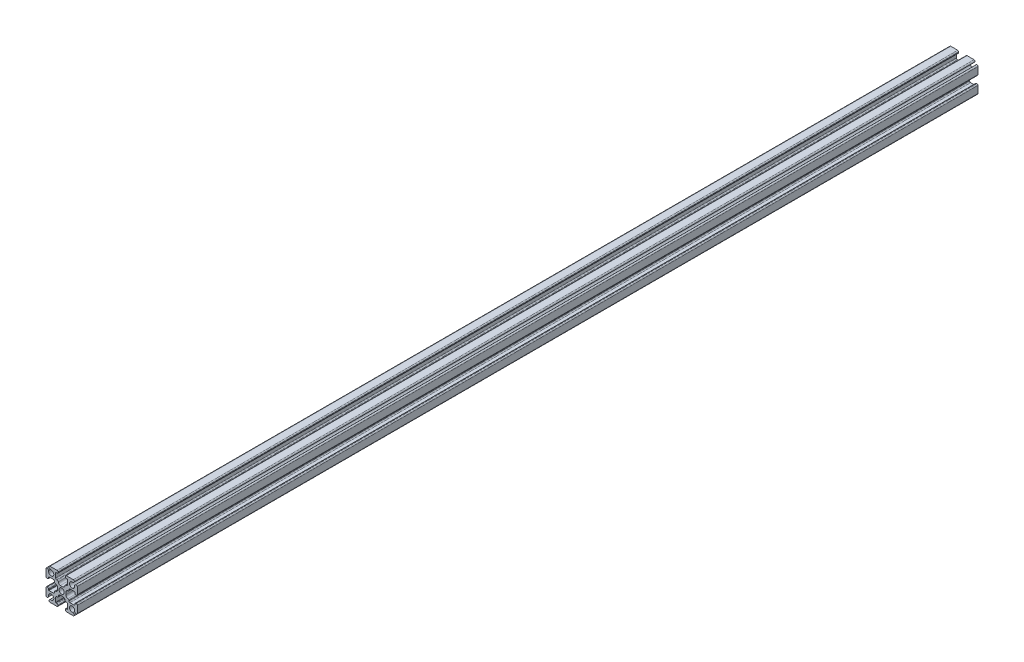
from build123d import *

# Parameters (mm, degrees)
SKETCH1_R           = 1.25
BOSS_EXTRUDE1_DEPTH = 432


with BuildPart() as part:
    # Sketch1 → Boss-Extrude1 (new body)
    with BuildSketch(Plane.XY):
        with BuildLine():
            Line((6.646446609, 5.939339828), (6.163645978, 5.456539197))
            ThreePointArc((6.163645978, 5.456539197), (4.116116524, 4.116116524), (5.456539197, 6.163645978))
            Line((5.456539197, 6.163645978), (5.939339828, 6.646446609))
            ThreePointArc((5.939339828, 6.646446609), (6.047726204, 7.191341716), (5.585786438, 7.5))
            Line((5.585786438, 7.5), (2.25, 7.5))
            ThreePointArc((2.25, 7.5), (1.896446609, 7.353553391), (1.75, 7))
            Line((1.75, 7), (1.75, 6.8))
            ThreePointArc((1.75, 6.8), (1.896446609, 6.446446609), (2.25, 6.3))
            Line((2.25, 6.3), (2.65, 6.3))
            ThreePointArc((2.65, 6.3), (2.791421356, 6.241421356), (2.85, 6.1))
            Line((2.85, 6.1), (2.85, 4))
            ThreePointArc((2.85, 4), (2.703553391, 3.646446609), (2.35, 3.5))
            Line((2.35, 3.5), (2.1, 3.5))
            ThreePointArc((2.1, 3.5), (1.746446609, 3.353553391), (1.6, 3))
            ThreePointArc((1.6, 3), (1.307106781, 2.292893219), (0.6, 2))
            Line((0.6, 2), (-0.6, 2))
            ThreePointArc((-0.6, 2), (-1.307106781, 2.292893219), (-1.6, 3))
            ThreePointArc((-1.6, 3), (-1.746446609, 3.353553391), (-2.1, 3.5))
            Line((-2.1, 3.5), (-2.35, 3.5))
            ThreePointArc((-2.35, 3.5), (-2.703553391, 3.646446609), (-2.85, 4))
            Line((-2.85, 4), (-2.85, 6.1))
            ThreePointArc((-2.85, 6.1), (-2.791421356, 6.241421356), (-2.65, 6.3))
            Line((-2.65, 6.3), (-2.25, 6.3))
            ThreePointArc((-2.25, 6.3), (-1.896446609, 6.446446609), (-1.75, 6.8))
            Line((-1.75, 6.8), (-1.75, 7))
            ThreePointArc((-1.75, 7), (-1.896446609, 7.353553391), (-2.25, 7.5))
            Line((-2.25, 7.5), (-5.585786438, 7.5))
            ThreePointArc((-5.585786438, 7.5), (-6.047726204, 7.191341716), (-5.939339828, 6.646446609))
            Line((-5.939339828, 6.646446609), (-5.456539197, 6.163645978))
            ThreePointArc((-5.456539197, 6.163645978), (-4.116116524, 4.116116524), (-6.163645978, 5.456539197))
            Line((-6.163645978, 5.456539197), (-6.646446609, 5.939339828))
            ThreePointArc((-6.646446609, 5.939339828), (-7.191341716, 6.047726204), (-7.5, 5.585786438))
            Line((-7.5, 5.585786438), (-7.5, 2.25))
            ThreePointArc((-7.5, 2.25), (-7.353553391, 1.896446609), (-7, 1.75))
            Line((-7, 1.75), (-6.8, 1.75))
            ThreePointArc((-6.8, 1.75), (-6.446446609, 1.896446609), (-6.3, 2.25))
            Line((-6.3, 2.25), (-6.3, 2.65))
            ThreePointArc((-6.3, 2.65), (-6.241421356, 2.791421356), (-6.1, 2.85))
            Line((-6.1, 2.85), (-4, 2.85))
            ThreePointArc((-4, 2.85), (-3.646446609, 2.703553391), (-3.5, 2.35))
            Line((-3.5, 2.35), (-3.5, 2.1))
            ThreePointArc((-3.5, 2.1), (-3.353553391, 1.746446609), (-3, 1.6))
            ThreePointArc((-3, 1.6), (-2.292893219, 1.307106781), (-2, 0.6))
            Line((-2, 0.6), (-2, -0.6))
            ThreePointArc((-2, -0.6), (-2.292893219, -1.307106781), (-3, -1.6))
            ThreePointArc((-3, -1.6), (-3.353553391, -1.746446609), (-3.5, -2.1))
            Line((-3.5, -2.1), (-3.5, -2.35))
            ThreePointArc((-3.5, -2.35), (-3.646446609, -2.703553391), (-4, -2.85))
            Line((-4, -2.85), (-6.1, -2.85))
            ThreePointArc((-6.1, -2.85), (-6.241421356, -2.791421356), (-6.3, -2.65))
            Line((-6.3, -2.65), (-6.3, -2.25))
            ThreePointArc((-6.3, -2.25), (-6.446446609, -1.896446609), (-6.8, -1.75))
            Line((-6.8, -1.75), (-7, -1.75))
            ThreePointArc((-7, -1.75), (-7.353553391, -1.896446609), (-7.5, -2.25))
            Line((-7.5, -2.25), (-7.5, -5.585786438))
            ThreePointArc((-7.5, -5.585786438), (-7.191341716, -6.047726204), (-6.646446609, -5.939339828))
            Line((-6.646446609, -5.939339828), (-6.163645978, -5.456539197))
            ThreePointArc((-6.163645978, -5.456539197), (-4.116116524, -4.116116524), (-5.456539197, -6.163645978))
            Line((-5.456539197, -6.163645978), (-5.939339828, -6.646446609))
            ThreePointArc((-5.939339828, -6.646446609), (-6.047726204, -7.191341716), (-5.585786438, -7.5))
            Line((-5.585786438, -7.5), (-2.25, -7.5))
            ThreePointArc((-2.25, -7.5), (-1.896446609, -7.353553391), (-1.75, -7))
            Line((-1.75, -7), (-1.75, -6.8))
            ThreePointArc((-1.75, -6.8), (-1.896446609, -6.446446609), (-2.25, -6.3))
            Line((-2.25, -6.3), (-2.65, -6.3))
            ThreePointArc((-2.65, -6.3), (-2.791421356, -6.241421356), (-2.85, -6.1))
            Line((-2.85, -6.1), (-2.85, -4))
            ThreePointArc((-2.85, -4), (-2.703553391, -3.646446609), (-2.35, -3.5))
            Line((-2.35, -3.5), (-2.1, -3.5))
            ThreePointArc((-2.1, -3.5), (-1.746446609, -3.353553391), (-1.6, -3))
            ThreePointArc((-1.6, -3), (-1.307106781, -2.292893219), (-0.6, -2))
            Line((-0.6, -2), (0.6, -2))
            ThreePointArc((0.6, -2), (1.307106781, -2.292893219), (1.6, -3))
            ThreePointArc((1.6, -3), (1.746446609, -3.353553391), (2.1, -3.5))
            Line((2.1, -3.5), (2.35, -3.5))
            ThreePointArc((2.35, -3.5), (2.703553391, -3.646446609), (2.85, -4))
            Line((2.85, -4), (2.85, -6.1))
            ThreePointArc((2.85, -6.1), (2.791421356, -6.241421356), (2.65, -6.3))
            Line((2.65, -6.3), (2.25, -6.3))
            ThreePointArc((2.25, -6.3), (1.896446609, -6.446446609), (1.75, -6.8))
            Line((1.75, -6.8), (1.75, -7))
            ThreePointArc((1.75, -7), (1.896446609, -7.353553391), (2.25, -7.5))
            Line((2.25, -7.5), (5.585786438, -7.5))
            ThreePointArc((5.585786438, -7.5), (6.047726204, -7.191341716), (5.939339828, -6.646446609))
            Line((5.939339828, -6.646446609), (5.456539197, -6.163645978))
            ThreePointArc((5.456539197, -6.163645978), (4.116116524, -4.116116524), (6.163645978, -5.456539197))
            Line((6.163645978, -5.456539197), (6.646446609, -5.939339828))
            ThreePointArc((6.646446609, -5.939339828), (7.191341716, -6.047726204), (7.5, -5.585786438))
            Line((7.5, -5.585786438), (7.5, -2.25))
            ThreePointArc((7.5, -2.25), (7.353553391, -1.896446609), (7, -1.75))
            Line((7, -1.75), (6.8, -1.75))
            ThreePointArc((6.8, -1.75), (6.446446609, -1.896446609), (6.3, -2.25))
            Line((6.3, -2.25), (6.3, -2.65))
            ThreePointArc((6.3, -2.65), (6.241421356, -2.791421356), (6.1, -2.85))
            Line((6.1, -2.85), (4, -2.85))
            ThreePointArc((4, -2.85), (3.646446609, -2.703553391), (3.5, -2.35))
            Line((3.5, -2.35), (3.5, -2.1))
            ThreePointArc((3.5, -2.1), (3.353553391, -1.746446609), (3, -1.6))
            ThreePointArc((3, -1.6), (2.292893219, -1.307106781), (2, -0.6))
            Line((2, -0.6), (2, 0.6))
            ThreePointArc((2, 0.6), (2.292893219, 1.307106781), (3, 1.6))
            ThreePointArc((3, 1.6), (3.353553391, 1.746446609), (3.5, 2.1))
            Line((3.5, 2.1), (3.5, 2.35))
            ThreePointArc((3.5, 2.35), (3.646446609, 2.703553391), (4, 2.85))
            Line((4, 2.85), (6.1, 2.85))
            ThreePointArc((6.1, 2.85), (6.241421356, 2.791421356), (6.3, 2.65))
            Line((6.3, 2.65), (6.3, 2.25))
            ThreePointArc((6.3, 2.25), (6.446446609, 1.896446609), (6.8, 1.75))
            Line((6.8, 1.75), (7, 1.75))
            ThreePointArc((7, 1.75), (7.353553391, 1.896446609), (7.5, 2.25))
            Line((7.5, 2.25), (7.5, 5.585786438))
            ThreePointArc((7.5, 5.585786438), (7.191341716, 6.047726204), (6.646446609, 5.939339828))
        make_face()
        with Locations(Location((0, 0, 0), (0, 0, 180))):
            Circle(SKETCH1_R, mode=Mode.SUBTRACT)
    extrude(amount=BOSS_EXTRUDE1_DEPTH)


solid = part.part
